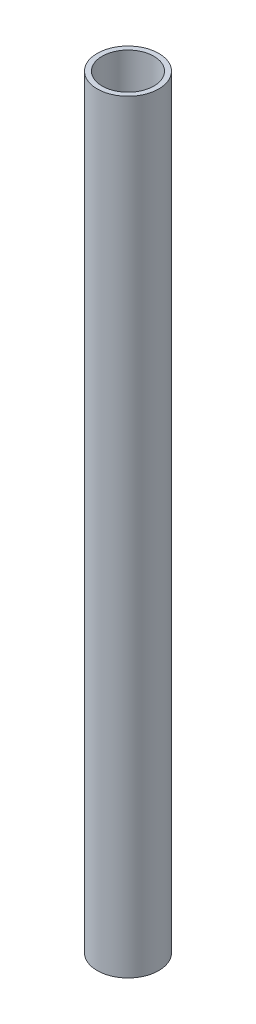
from build123d import *

# Parameters (mm, degrees)
CROQUIS1_R              = 12.5
CROQUIS1_R_2            = 10.5
SALIENTE_EXTRUIR1_DEPTH = 310


with BuildPart() as part:
    # Croquis1 → Saliente-Extruir1 (new body)
    with BuildSketch(Plane(origin=(0, 0, 0), x_dir=(1, 0, 0), z_dir=(0, 1, 0))):
        with Locations(Location((0, 0, 0), (0, 0, 270))):
            Circle(CROQUIS1_R)
        with Locations(Location((0, 0, 0), (0, 0, 270))):
            Circle(CROQUIS1_R_2, mode=Mode.SUBTRACT)
    extrude(amount=SALIENTE_EXTRUIR1_DEPTH)


solid = part.part
